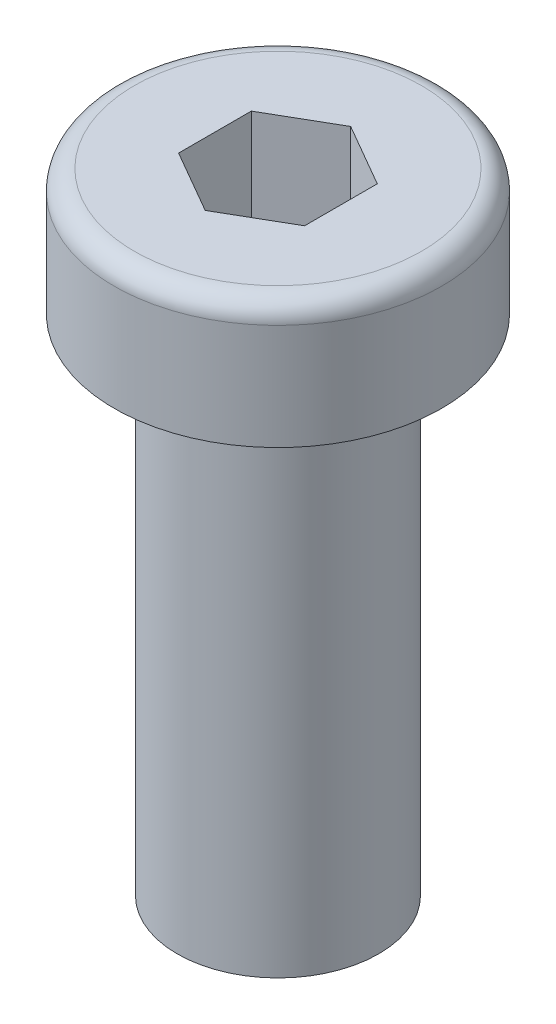
from build123d import *

# Parameters (mm, degrees)
CUT_EXTRUDE1_DEPTH = 4.2


with BuildPart() as part:
    # Sketch1 → Revolve1 (revolve)
    with BuildSketch(Plane.XY, mode=Mode.PRIVATE) as revolve1_sk:
        with BuildLine():
            Line((0, 25), (-5.7, 25))
            ThreePointArc((-5.7, 25), (-6.265685425, 24.765685425), (-6.5, 24.2))
            Line((-6.5, 24.2), (-6.5, 20))
            Line((-6.5, 20), (-4, 20))
            Line((-4, 20), (-4, 0))
            Line((-4, 0), (0, 0))
            Line((0, 0), (0, 25))
        make_face()
    revolve(revolve1_sk.sketch.rotate(Axis((0, 0, 0), (0, 1, 0)), 270), axis=Axis((0, 0, 0), (0, 1, 0)))

    # Sketch2 → Cut-Extrude1 (cut)
    with BuildSketch(Plane(origin=(0, 25, 0), x_dir=(1, 0, 0), z_dir=(0, 1, 0))):
        Polygon((0, 2.886751346), (-2.5, 1.443375673), (-2.5, -1.443375673), (0, -2.886751346), (2.5, -1.443375673), (2.5, 1.443375673), align=None)
    extrude(amount=-CUT_EXTRUDE1_DEPTH, mode=Mode.SUBTRACT)


solid = part.part
